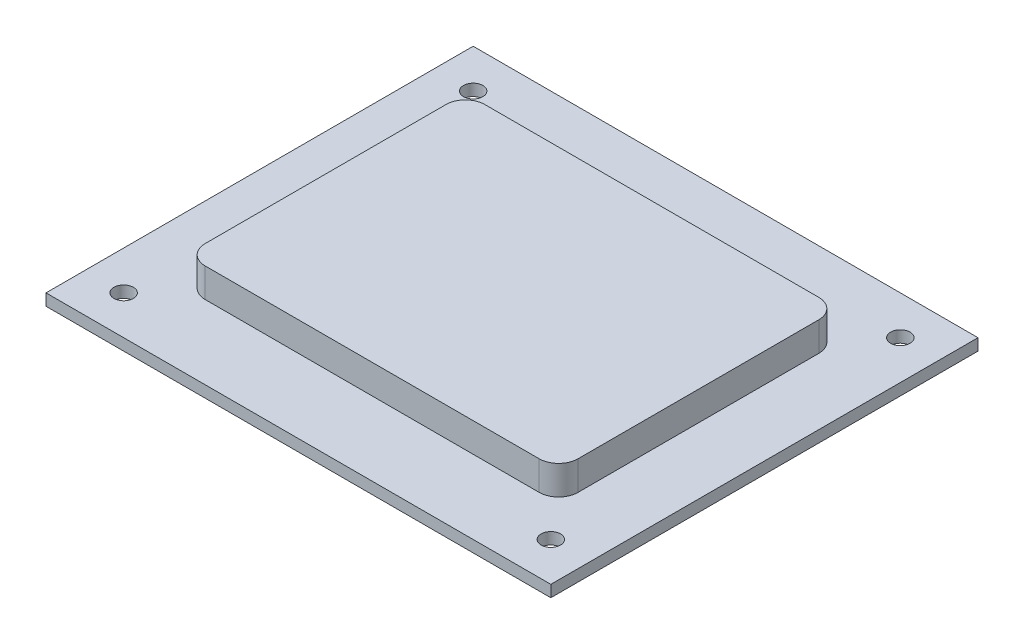
from build123d import *

# Parameters (mm, degrees)
BOSS_EXTRUDE1_DEPTH = 4.7625
SKETCH3_W           = 82.55
SKETCH3_H           = 69.85
BOSS_EXTRUDE2_DEPTH = 1.905
SKETCH4_R           = 1.5875
CUT_EXTRUDE1_DEPTH  = 71.351665255


with BuildPart() as part:
    # Sketch1 → Boss-Extrude1 (new body)
    with BuildSketch(Plane(origin=(0, 0, 0), x_dir=(1, 0, 0), z_dir=(0, 1, 0))):
        with BuildLine():
            Line((-46.283113208, 21.781698113), (8.326886792, 21.781698113))
            ThreePointArc((8.326886792, 21.781698113), (10.571950823, 20.851762143), (11.501886792, 18.606698113))
            Line((11.501886792, 18.606698113), (11.501886792, -20.763301887))
            ThreePointArc((11.501886792, -20.763301887), (10.571950823, -23.008365917), (8.326886792, -23.938301887))
            Line((8.326886792, -23.938301887), (-46.283113208, -23.938301887))
            ThreePointArc((-46.283113208, -23.938301887), (-48.528177238, -23.008365917), (-49.458113208, -20.763301887))
            Line((-49.458113208, -20.763301887), (-49.458113208, 18.606698113))
            ThreePointArc((-49.458113208, 18.606698113), (-48.528177238, 20.851762143), (-46.283113208, 21.781698113))
        make_face()
    extrude(amount=BOSS_EXTRUDE1_DEPTH)

    # Sketch3 → Boss-Extrude2 (add)
    with BuildSketch(Plane.XZ):
        with Locations((-18.978113208, 1.078301887)):
            Rectangle(SKETCH3_W, SKETCH3_H)
    extrude(amount=BOSS_EXTRUDE2_DEPTH)

    # Sketch4 → Cut-Extrude1 (cut, through all)
    with BuildSketch(Plane(origin=(0, 0, 0), x_dir=(1, 0, 0), z_dir=(0, 1, 0))):
        with Locations(Location((-53.903113208, 27.496698113, 0), (0, 0, 270))):
            Circle(SKETCH4_R)
        with Locations(Location((15.946886792, 27.496698113, 0), (0, 0, 270))):
            Circle(SKETCH4_R)
        with Locations(Location((15.946886792, -29.653301887, 0), (0, 0, 270))):
            Circle(SKETCH4_R)
        with Locations(Location((-53.903113208, -29.653301887, 0), (0, 0, 270))):
            Circle(SKETCH4_R)
    extrude(amount=-CUT_EXTRUDE1_DEPTH, mode=Mode.SUBTRACT)


solid = part.part
